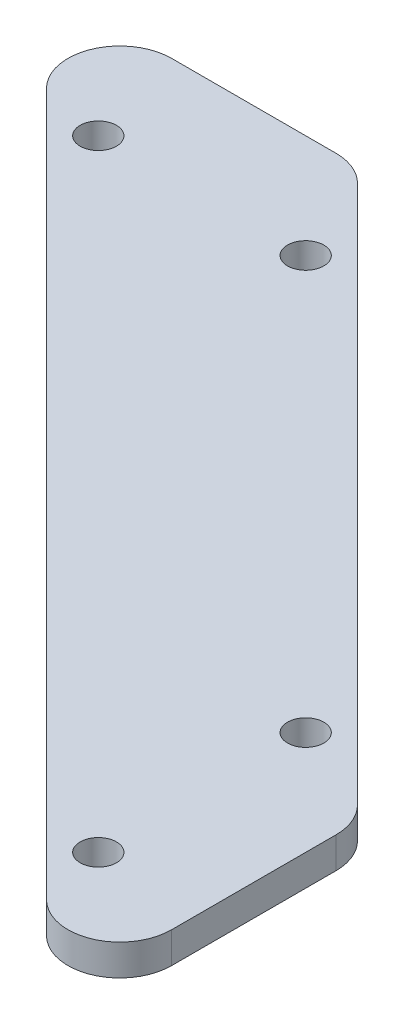
from build123d import *

# Parameters (mm, degrees)
BOSS_EXTRUDE1_DEPTH = 3
SKETCH2_R           = 1.75
CUT_EXTRUDE1_DEPTH  = 121.037494142
FILLET2_R           = 5


with BuildPart() as part:
    # Sketch1 → Boss-Extrude1 (new body)
    with BuildSketch(Plane(origin=(0, 0, 0), x_dir=(1, 0, 0), z_dir=(0, 1, 0))):
        Polygon((0, 0), (-84.852813742, 84.852813742), (-54.852813742, 84.852813742), (0, 30), align=None)
    extrude(amount=BOSS_EXTRUDE1_DEPTH)

    # Sketch2 → Cut-Extrude1 (cut, through all)
    with BuildSketch(Plane(origin=(0, 3, 0), x_dir=(1, 0, 0), z_dir=(0, 1, 0))):
        with Locations(Location((-69.852813742, 74.852813742, 0), (0, 0, 270))):
            Circle(SKETCH2_R)
        with Locations(Location((-49.852813742, 74.852813742, 0), (0, 0, 270))):
            Circle(SKETCH2_R)
        with Locations(Location((-10, 15, 0), (0, 0, 270))):
            Circle(SKETCH2_R)
        with Locations(Location((-10, 35, 0), (0, 0, 270))):
            Circle(SKETCH2_R)
    extrude(amount=-CUT_EXTRUDE1_DEPTH, mode=Mode.SUBTRACT)

    # Fillet2
    fillet2_edges = [part.edges().sort_by_distance(p)[0] for p in [
        (0, 1.5, 0),
        (-84.852813742, 1.5, -84.852813742),
        (-54.852813742, 1.5, -84.852813742),
        (0, 1.5, -30),
    ]]
    fillet(fillet2_edges, radius=FILLET2_R)


solid = part.part
